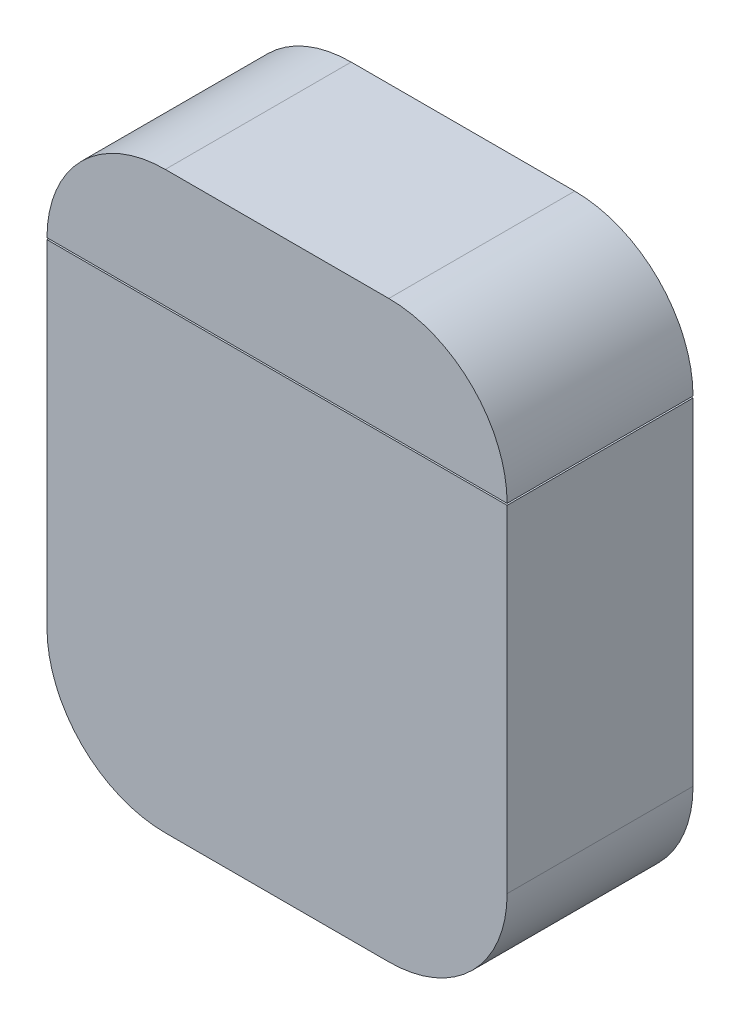
from build123d import *

# Parameters (mm, degrees)
BOSS_EXTRUDE1_DEPTH     = 139.7
SKETCH2_W               = 345.783161942
SKETCH2_H               = 1.27
CUT_EXTRUDE1_DEPTH      = 5.08
SKETCH3_W               = 134.62
SKETCH3_H               = 1.27
CUT_EXTRUDE2_DEPTH      = 5.08
SKETCH4_W               = 134.62
SKETCH4_H               = 1.27
CUT_EXTRUDE3_DEPTH      = 5.08
SKETCH5_W               = 76.2
SKETCH5_H               = 1.27
CUT_EXTRUDE4_DEPTH      = 5.08
CUT_EXTRUDE_THIN1_DEPTH = 2.54
SKETCH8_W               = 0.683613246
SKETCH8_H               = 35.161225601
SKETCH8_W_2             = 0.852269187
CUT_EXTRUDE5_DEPTH      = 2.54
SKETCH9_R               = 27.432823907
SKETCH9_R_2             = 24.892823907
CUT_EXTRUDE_THIN2_DEPTH = 2.54


with BuildPart() as part:
    # Sketch1 → Boss-Extrude1 (new body)
    with BuildSketch(Plane.XY):
        with BuildLine():
            Line((109.030585849, 26.343843493), (-58.952576093, 26.343843493))
            ThreePointArc((-58.952576093, 26.343843493), (-121.814368941, 0.30563634), (-147.852576093, -62.556156507))
            Line((-147.852576093, -62.556156507), (-147.852576093, -316.556156507))
            ThreePointArc((-147.852576093, -316.556156507), (-121.814368941, -379.417949355), (-58.952576093, -405.456156507))
            Line((-58.952576093, -405.456156507), (109.030585849, -405.456156507))
            ThreePointArc((109.030585849, -405.456156507), (171.892378697, -379.417949355), (197.930585849, -316.556156507))
            Line((197.930585849, -316.556156507), (197.930585849, -62.556156507))
            ThreePointArc((197.930585849, -62.556156507), (171.892378697, 0.30563634), (109.030585849, 26.343843493))
        make_face()
    extrude(amount=BOSS_EXTRUDE1_DEPTH)

    # Sketch2 → Cut-Extrude1 (cut)
    with BuildSketch(Plane.XY.offset(139.7)):
        with Locations((25.039004878, -63.191156507)):
            Rectangle(SKETCH2_W, SKETCH2_H)
    extrude(amount=-CUT_EXTRUDE1_DEPTH, mode=Mode.SUBTRACT)

    # Sketch3 → Cut-Extrude2 (cut)
    with BuildSketch(Plane.ZY.offset(147.852576093)):
        with Locations((67.31, -63.191156507)):
            Rectangle(SKETCH3_W, SKETCH3_H)
    extrude(amount=-CUT_EXTRUDE2_DEPTH, mode=Mode.SUBTRACT)

    # Sketch4 → Cut-Extrude3 (cut)
    with BuildSketch(Plane(origin=(197.930585849, 0, 0), x_dir=(0, 0, -1), z_dir=(1, 0, 0))):
        with Locations((-67.31, -63.191156507)):
            Rectangle(SKETCH4_W, SKETCH4_H)
    extrude(amount=-CUT_EXTRUDE3_DEPTH, mode=Mode.SUBTRACT)

    # Sketch5 → Cut-Extrude4 (cut)
    with BuildSketch(Plane(origin=(0, 0, 0), x_dir=(-1, 0, 0), z_dir=(0, 0, -1))):
        with Locations((-154.750585849, -63.191156507)):
            Rectangle(SKETCH5_W, SKETCH5_H)
        with Locations((104.672576093, -63.191156507)):
            Rectangle(SKETCH5_W, SKETCH5_H)
    extrude(amount=-CUT_EXTRUDE4_DEPTH, mode=Mode.SUBTRACT)

    # Sketch7 → Cut-Extrude-Thin1 (cut)
    with BuildSketch(Plane(origin=(0, 0, 0), x_dir=(-1, 0, 0), z_dir=(0, 0, -1))):
        with BuildLine():
            Line((80.517176093, -100.257382108), (-130.302823907, -100.257382108))
            ThreePointArc((-130.302823907, -100.257382108), (-141.079131252, -95.793689453), (-145.542823907, -85.017382108))
            Line((-145.542823907, -85.017382108), (-145.542823907, -63.826156507))
            Line((-145.542823907, -63.826156507), (-145.542823907, -60.016156507))
            Line((-145.542823907, -60.016156507), (95.757176093, -60.016156507))
            Line((95.757176093, -60.016156507), (95.757176093, -63.826156507))
            Line((95.757176093, -63.826156507), (95.757176093, -85.017382108))
            ThreePointArc((95.757176093, -85.017382108), (91.293483439, -95.793689453), (80.517176093, -100.257382108))
        make_face()
        with BuildLine():
            Line((80.517176093, -97.717382108), (-130.302823907, -97.717382108))
            ThreePointArc((-130.302823907, -97.717382108), (-139.283080028, -93.997638229), (-143.002823907, -85.017382108))
            Line((-143.002823907, -85.017382108), (-143.002823907, -63.826156507))
            Line((-143.002823907, -63.826156507), (-143.002823907, -62.556156507))
            Line((-143.002823907, -62.556156507), (93.217176093, -62.556156507))
            Line((93.217176093, -62.556156507), (93.217176093, -63.826156507))
            Line((93.217176093, -63.826156507), (93.217176093, -85.017382108))
            ThreePointArc((93.217176093, -85.017382108), (89.497432214, -93.997638229), (80.517176093, -97.717382108))
        make_face(mode=Mode.SUBTRACT)
    extrude(amount=-CUT_EXTRUDE_THIN1_DEPTH, mode=Mode.SUBTRACT)

    # Sketch8 → Cut-Extrude5 (cut)
    with BuildSketch(Plane(origin=(0, 0, 0), x_dir=(-1, 0, 0), z_dir=(0, 0, -1))):
        with Locations((-116.308779226, -80.136769308)):
            Rectangle(SKETCH8_W, SKETCH8_H)
        with Locations((66.1464415, -80.136769308)):
            Rectangle(SKETCH8_W_2, SKETCH8_H)
    extrude(amount=-CUT_EXTRUDE5_DEPTH, mode=Mode.SUBTRACT)

    # Sketch9 → Cut-Extrude-Thin2 (cut)
    with BuildSketch(Plane(origin=(0, 0, 0), x_dir=(-1, 0, 0), z_dir=(0, 0, -1))):
        with Locations((-24.892823907, -221.511266295)):
            Circle(SKETCH9_R)
        with Locations((-24.892823907, -221.511266295)):
            Circle(SKETCH9_R_2, mode=Mode.SUBTRACT)
    extrude(amount=-CUT_EXTRUDE_THIN2_DEPTH, mode=Mode.SUBTRACT)


solid = part.part
